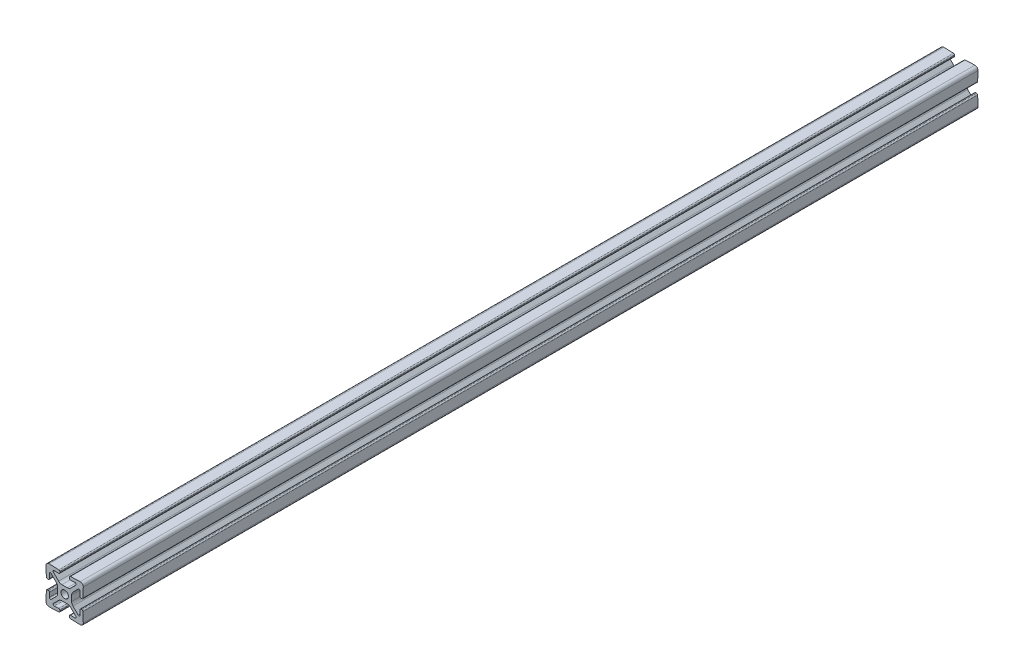
from build123d import *

# Parameters (mm, degrees)
BOSS_EXTRUDE1_DEPTH = 304.8
CIRPATTERN1_COUNT   = 4


with BuildPart() as part:
    # Sketch3 → Boss-Extrude1 (new, symmetric)
    with BuildSketch(Plane.XY):
        with BuildLine():
            Line((0, 4.7625), (-1.884807374, 4.7625))
            ThreePointArc((-1.884807374, 4.7625), (-3.099827272, 5.004182484), (-4.129871405, 5.69243597))
            Line((-4.129871405, 5.69243597), (-7.599623114, 9.162187679))
            ThreePointArc((-7.599623114, 9.162187679), (-7.759888701, 10.006330839), (-7.033220609, 10.464824259))
            Line((-7.033220609, 10.464824259), (-4.047481702, 10.360559959))
            ThreePointArc((-4.047481702, 10.360559959), (-3.501205536, 10.564804249), (-3.259352476, 11.095502353))
            Line((-3.259352476, 11.095502353), (-3.23896419, 11.679346474))
            ThreePointArc((-3.23896419, 11.679346474), (-3.443208479, 12.225622641), (-3.973906584, 12.467475701))
            Line((-3.973906584, 12.467475701), (-10.597084223, 12.698762161))
            ThreePointArc((-10.597084223, 12.698762161), (-12.104840979, 12.104840979), (-12.698762161, 10.597084223))
            Line((-12.698762161, 10.597084223), (-12.467475701, 3.973906584))
            ThreePointArc((-12.467475701, 3.973906584), (-12.225622641, 3.443208479), (-11.679346474, 3.23896419))
            Line((-11.679346474, 3.23896419), (-11.095502353, 3.259352476))
            ThreePointArc((-11.095502353, 3.259352476), (-10.564804249, 3.501205536), (-10.360559959, 4.047481702))
            Line((-10.360559959, 4.047481702), (-10.464824259, 7.033220609))
            ThreePointArc((-10.464824259, 7.033220609), (-10.006330839, 7.759888701), (-9.162187679, 7.599623114))
            Line((-9.162187679, 7.599623114), (-5.69243597, 4.129871405))
            ThreePointArc((-5.69243597, 4.129871405), (-5.004182484, 3.099827272), (-4.7625, 1.884807374))
            Line((-4.7625, 1.884807374), (-4.7625, 0))
            Line((-4.7625, 0), (-2.54, 0))
            ThreePointArc((-2.54, 0), (-1.796051224, 1.796051224), (0, 2.54))
            Line((0, 2.54), (0, 4.7625))
        make_face()
    boss_extrude1 = extrude(amount=BOSS_EXTRUDE1_DEPTH, both=True)

    # CirPattern1: Boss-Extrude1 ×4 about axis
    cirpattern1_axis = Axis((0, 0, 0), (0, 0, 1))
    for i in range(1, CIRPATTERN1_COUNT):
        add(boss_extrude1.rotate(cirpattern1_axis, i * 360 / CIRPATTERN1_COUNT))


solid = part.part
